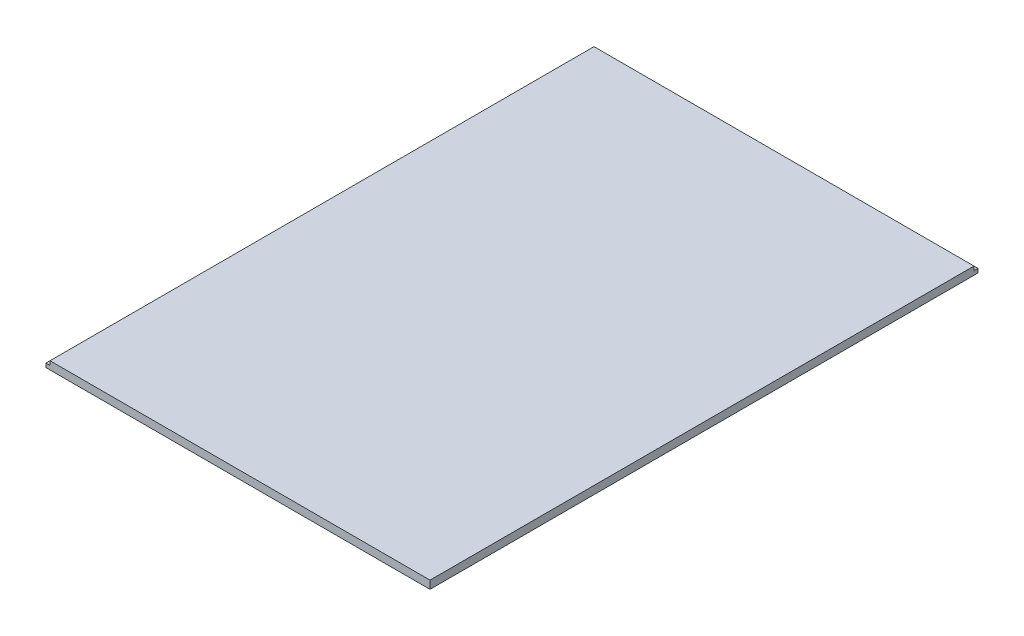
from build123d import *

# Parameters (mm, degrees)
SKETCH1_W           = 304.8
SKETCH1_H           = 434.975
BOSS_EXTRUDE1_DEPTH = 6.35
CUT_EXTRUDE1_DEPTH  = 3.175


with BuildPart() as part:
    # Sketch1 → Boss-Extrude1 (new body)
    with BuildSketch(Plane(origin=(0, 0, 0), x_dir=(1, 0, 0), z_dir=(0, 1, 0))):
        with Locations((152.4, 217.4875)):
            Rectangle(SKETCH1_W, SKETCH1_H)
    extrude(amount=BOSS_EXTRUDE1_DEPTH)

    # Sketch2 → Cut-Extrude1 (cut)
    with BuildSketch(Plane(origin=(0, 6.35, 0), x_dir=(1, 0, 0), z_dir=(0, 1, 0))):
        Polygon((3.175, 0), (3.175, 431.8), (304.8, 431.8), (304.8, 434.975), (0, 434.975), (0, 0), align=None)
    extrude(amount=-CUT_EXTRUDE1_DEPTH, mode=Mode.SUBTRACT)


solid = part.part
